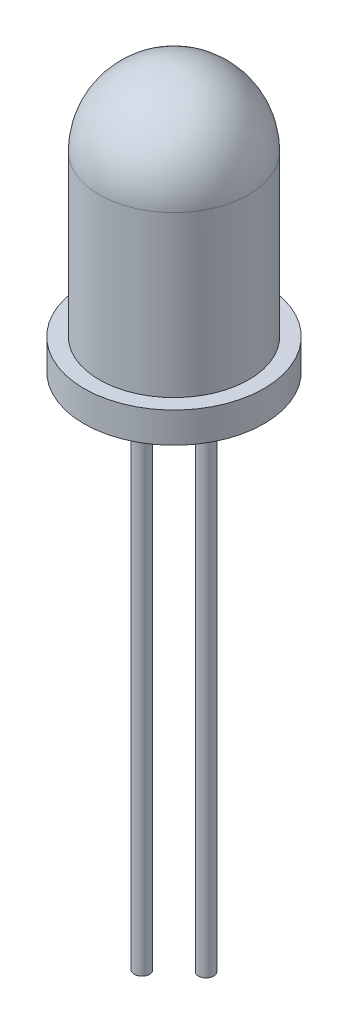
from build123d import *

# Parameters (mm, degrees)
CROQUIS1_R                   = 2.95
SALIENTE_EXTRUIR1_DEPTH      = 1
CORTAR_EXTRUIR1_START        = -0.5
CROQUIS4_R                   = 2.45
CORTAR_EXTRUIR1_DEPTH        = 0.5
SALIENTE_EXTRUIR2_DEPTH      = 18
SALIENTE_EXTRUIR2_DEPTH_BACK = 2
CROQUIS5_R                   = 0.25
CORTAR_EXTRUIR2_START        = -1
CROQUIS6_R                   = 0.25
CORTAR_EXTRUIR2_DEPTH        = 1


with BuildPart() as part:
    # Croquis1 → Saliente-Extruir1 (new body)
    with BuildSketch(Plane(origin=(0, 0, 0), x_dir=(1, 0, 0), z_dir=(0, 1, 0))):
        with Locations(Location((0, 0, 0), (0, 0, 270))):
            Circle(CROQUIS1_R)
    extrude(amount=SALIENTE_EXTRUIR1_DEPTH)

    # Croquis2 → Revolución1 (revolve)
    with BuildSketch(Plane.XY):
        with BuildLine():
            Line((0, 1), (-2.45, 1))
            Line((-2.45, 1), (-2.45, 6.25))
            ThreePointArc((-2.45, 6.25), (-1.732411614, 7.982411614), (0, 8.7))
            Line((0, 8.7), (0, 1))
        make_face()
    revolve(axis=Axis((0, 0, 0), (0, 1, 0)))

    # Croquis4 → Cortar-Extruir1 (cut)
    with BuildSketch(Plane(origin=(0, 0, 0), x_dir=(-1, 0, 0), z_dir=(0, -1, 0)).offset(CORTAR_EXTRUIR1_START)):
        with Locations(Location((0, 0, 0), (0, 0, 90))):
            Circle(CROQUIS4_R)
    extrude(amount=CORTAR_EXTRUIR1_DEPTH, mode=Mode.SUBTRACT)

    # Croquis5 → Saliente-Extruir2 (add, two sides: drawn at the far end of the back side and taken through both)
    with BuildSketch(Plane.XZ.offset(-0.5).offset(-SALIENTE_EXTRUIR2_DEPTH_BACK)):
        with Locations(Location((-1.05, 0, 0), (0, 0, 270))):
            Circle(CROQUIS5_R)
        with Locations(Location((1.05, 0, 0), (0, 0, 270))):
            Circle(CROQUIS5_R)
    extrude(amount=SALIENTE_EXTRUIR2_DEPTH + SALIENTE_EXTRUIR2_DEPTH_BACK)

    # Croquis6 → Cortar-Extruir2 (cut)
    with BuildSketch(Plane.XZ.offset(17.5).offset(CORTAR_EXTRUIR2_START)):
        with Locations(Location((1.05, 0, 0), (0, 0, 270))):
            Circle(CROQUIS6_R)
    extrude(amount=CORTAR_EXTRUIR2_DEPTH, mode=Mode.SUBTRACT)


solid = part.part
